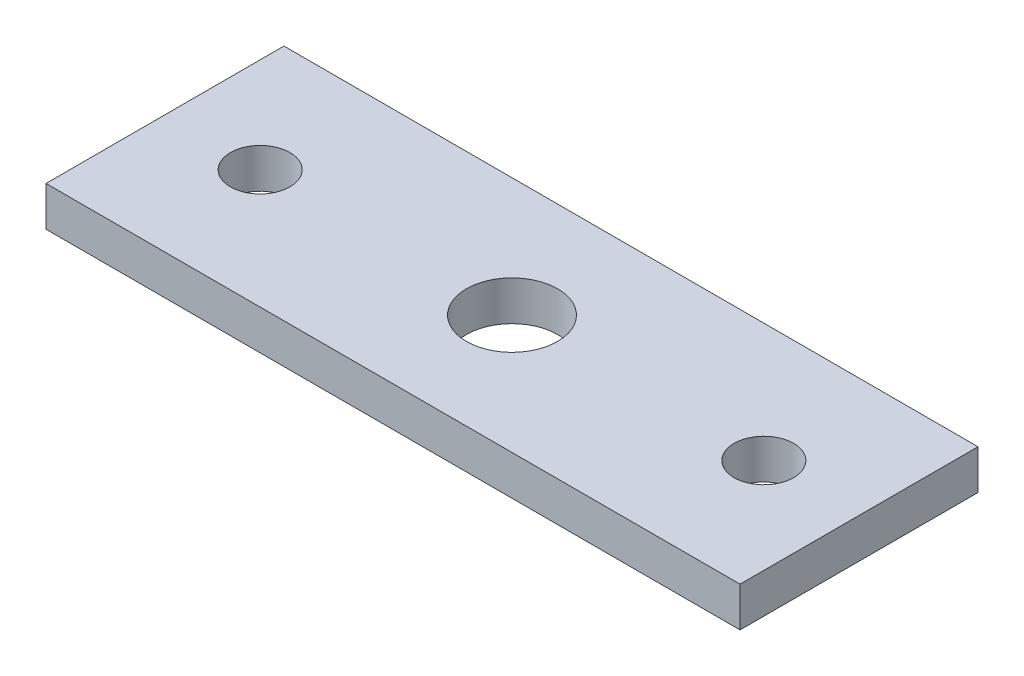
from build123d import *

# Parameters (mm, degrees)
SKETCH1_W           = 35
SKETCH1_H           = 12
SKETCH1_R           = 2.3
SKETCH1_R_2         = 1.5
BOSS_EXTRUDE1_DEPTH = 2


with BuildPart() as part:
    # Sketch1 → Boss-Extrude1 (new body)
    with BuildSketch(Plane(origin=(0, 0, 0), x_dir=(1, 0, 0), z_dir=(0, 1, 0))):
        Rectangle(SKETCH1_W, SKETCH1_H)
        with Locations(Location((0, 0, 0), (0, 0, 270))):
            Circle(SKETCH1_R, mode=Mode.SUBTRACT)
        with Locations(Location((12.7, 0, 0), (0, 0, 270))):
            Circle(SKETCH1_R_2, mode=Mode.SUBTRACT)
        with Locations(Location((-12.7, 0, 0), (0, 0, 90))):
            Circle(SKETCH1_R_2, mode=Mode.SUBTRACT)
    extrude(amount=BOSS_EXTRUDE1_DEPTH)


solid = part.part
